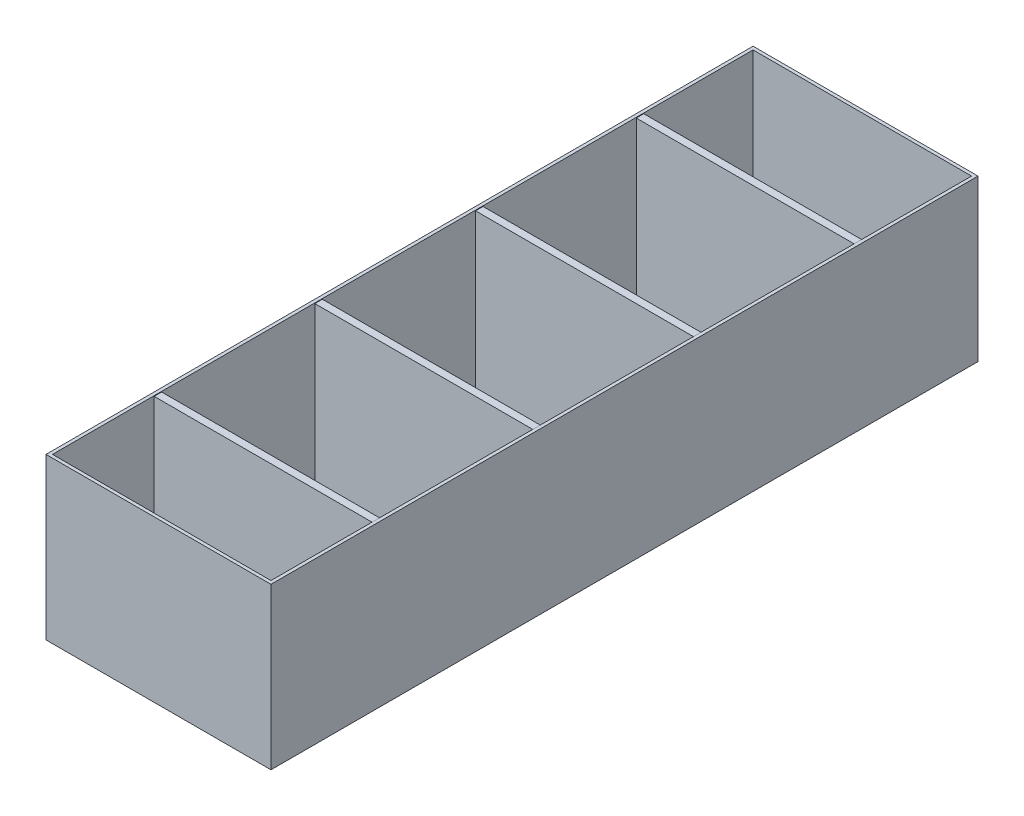
from build123d import *

# Parameters (mm, degrees)
CROQUIS1_W              = 700
CROQUIS1_H              = 500
SALIENTE_EXTRUIR1_DEPTH = 2200
VACIADO1_T              = -10
CROQUIS2_W              = 680
CROQUIS2_H              = 23.319411046
SALIENTE_EXTRUIR2_DEPTH = 488
MATRIZL1_COUNT          = 4
MATRIZL1_PITCH          = 500


with BuildPart() as part:
    # Croquis1 → Saliente-Extruir1 (new body)
    with BuildSketch(Plane.XY):
        Rectangle(CROQUIS1_W, CROQUIS1_H)
    extrude(amount=SALIENTE_EXTRUIR1_DEPTH)

    # Vaciado1
    vaciado1_openings = [part.faces().sort_by_distance(p)[0] for p in [
        (0, 250, 1100),
    ]]
    offset(amount=VACIADO1_T, openings=vaciado1_openings, kind=Kind.INTERSECTION)

    # Croquis2 → Saliente-Extruir2 (add)
    with BuildSketch(Plane(origin=(0, -240, 0), x_dir=(1, 0, 0), z_dir=(0, 1, 0))):
        with Locations((0, -361.692736208)):
            Rectangle(CROQUIS2_W, CROQUIS2_H)
    saliente_extruir2 = extrude(amount=SALIENTE_EXTRUIR2_DEPTH)

    # MatrizL1: Saliente-Extruir2 ×4
    with Locations(*[(0, 0, i * MATRIZL1_PITCH) for i in range(1, MATRIZL1_COUNT)]):
        add(saliente_extruir2)


solid = part.part
